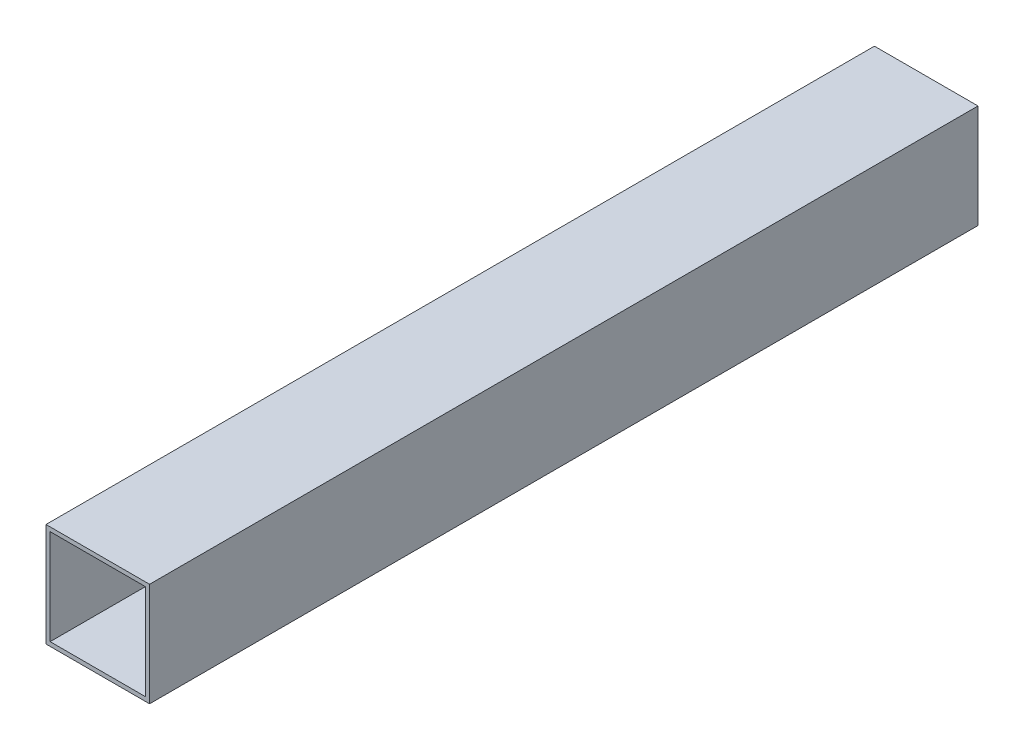
from build123d import *

# Parameters (mm, degrees)
ESBO_O1_W                = 50
ESBO_O1_H                = 50
ESBO_O1_W_2              = 46
ESBO_O1_H_2              = 46
RESSALTO_EXTRUS_O1_DEPTH = 400


with BuildPart() as part:
    # Esboço1 → Ressalto-extrusão1 (new body)
    with BuildSketch(Plane.XY):
        with Locations((25, 25)):
            Rectangle(ESBO_O1_W, ESBO_O1_H)
        with Locations((25, 25)):
            Rectangle(ESBO_O1_W_2, ESBO_O1_H_2, mode=Mode.SUBTRACT)
    extrude(amount=RESSALTO_EXTRUS_O1_DEPTH)


solid = part.part
